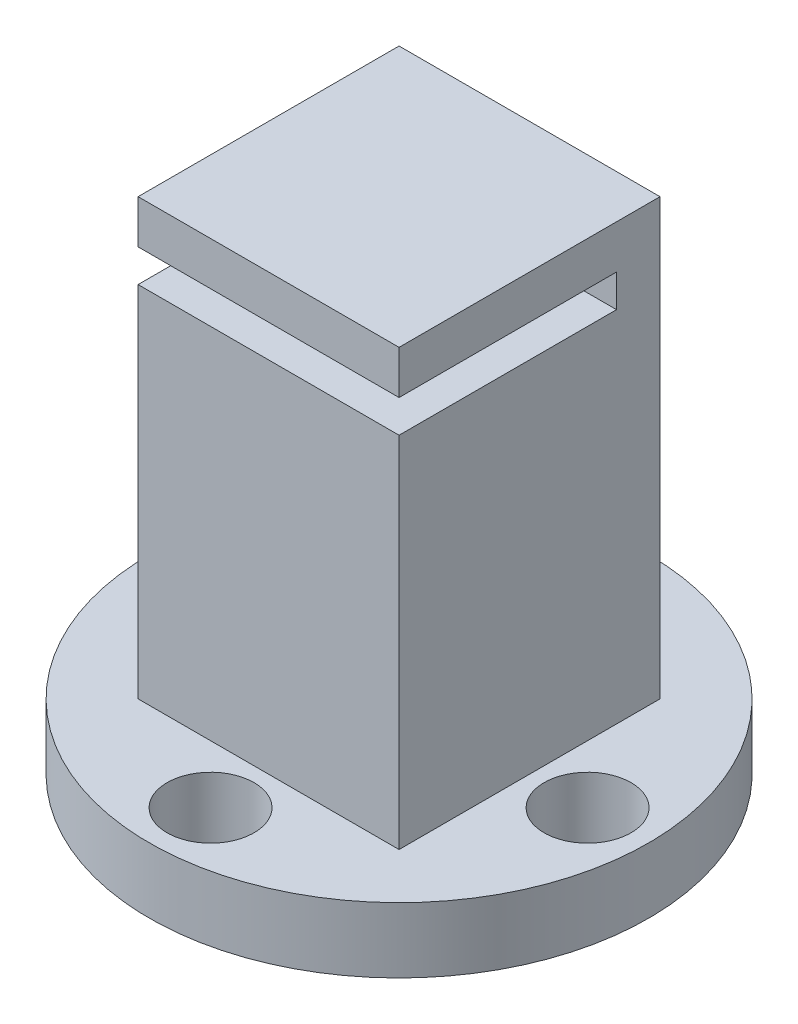
from build123d import *

# Parameters (mm, degrees)
CROQUIS1_W              = 12
CROQUIS1_H              = 12
SALIENTE_EXTRUIR1_DEPTH = 20
CROQUIS2_W              = 12
CROQUIS2_H              = 1.5
CORTAR_EXTRUIR1_DEPTH   = 10
CROQUIS3_R              = 11.478178836
CROQUIS3_R_2            = 2
SALIENTE_EXTRUIR2_DEPTH = 3


with BuildPart() as part:
    # Croquis1 → Saliente-Extruir1 (new body)
    with BuildSketch(Plane(origin=(0, 0, 0), x_dir=(1, 0, 0), z_dir=(0, 1, 0))):
        with Locations((6, 6)):
            Rectangle(CROQUIS1_W, CROQUIS1_H)
    extrude(amount=SALIENTE_EXTRUIR1_DEPTH)

    # Croquis2 → Cortar-Extruir1 (cut)
    with BuildSketch(Plane.XY):
        with Locations((6, 17.25)):
            Rectangle(CROQUIS2_W, CROQUIS2_H)
    extrude(amount=-CORTAR_EXTRUIR1_DEPTH, mode=Mode.SUBTRACT)

    # Croquis3 → Saliente-Extruir2 (add)
    with BuildSketch(Plane.XZ):
        with Locations(Location((6, -6, 0), (0, 0, 270))):
            Circle(CROQUIS3_R)
        with Locations(Location((14.668474488, -6, 0), (0, 0, 270))):
            Circle(CROQUIS3_R_2, mode=Mode.SUBTRACT)
        with Locations(Location((6, -14.668474488, 0), (0, 0, 270))):
            Circle(CROQUIS3_R_2, mode=Mode.SUBTRACT)
        with Locations(Location((-2.668474488, -6, 0), (0, 0, 270))):
            Circle(CROQUIS3_R_2, mode=Mode.SUBTRACT)
        with Locations(Location((6, 2.668474488, 0), (0, 0, 270))):
            Circle(CROQUIS3_R_2, mode=Mode.SUBTRACT)
    extrude(amount=SALIENTE_EXTRUIR2_DEPTH)


solid = part.part
